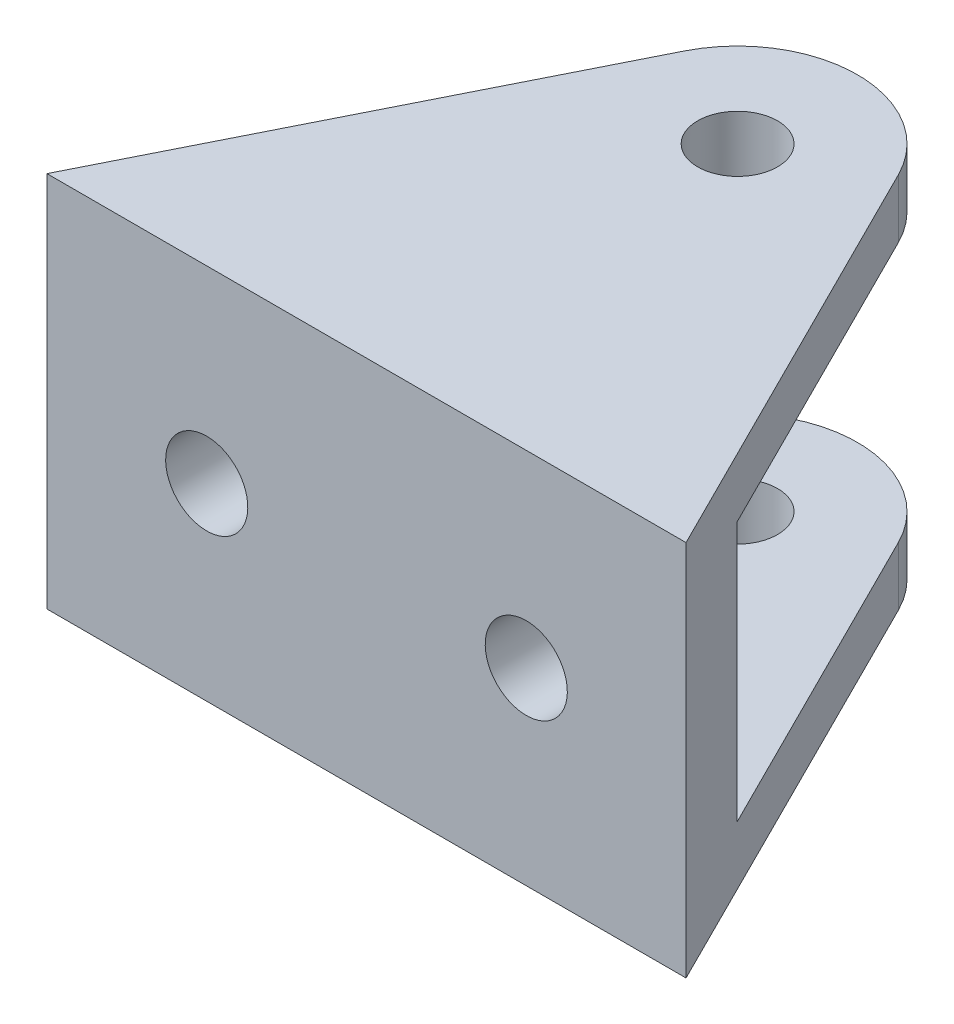
from build123d import *

# Parameters (mm, degrees)
BOSS_EXTRUDE1_DEPTH                                  = 50.8
CBORE_FOR_1_4_BINDING_HEAD_MACHINE_SCREW_D           = 6.5278
CBORE_FOR_1_4_BINDING_HEAD_MACHINE_SCREW_CBORE_D     = 14.2875
CBORE_FOR_1_4_BINDING_HEAD_MACHINE_SCREW_CBORE_DEPTH = 3.302
CUT_EXTRUDE1_REACH                                   = 73.186
SKETCH4_R                                            = 3.175


with BuildPart() as part:
    # Sketch1 → Boss-Extrude1 (new body)
    with BuildSketch(Plane(origin=(0, 0, 0), x_dir=(0, 0, -1), z_dir=(1, 0, 0))):
        Polygon((0, 0), (0, 29.972), (39.856315031, 29.972), (39.856315031, 25.3111), (8.106315031, 25.3111), (8.106315031, 4.6609), (39.856315031, 4.6609), (39.856315031, 0), align=None)
    extrude(amount=BOSS_EXTRUDE1_DEPTH)

    # CBORE for 1/4 Binding Head Machine Screw1 (through all)
    with Locations(Plane(origin=(0, 0, -8.106315031), x_dir=(-1, 0, 0), z_dir=(0, 0, -1))):
        with Locations((-12.7, 14.986), (-38.1, 14.986)):
            CounterBoreHole(CBORE_FOR_1_4_BINDING_HEAD_MACHINE_SCREW_D / 2, CBORE_FOR_1_4_BINDING_HEAD_MACHINE_SCREW_CBORE_D / 2, CBORE_FOR_1_4_BINDING_HEAD_MACHINE_SCREW_CBORE_DEPTH)

    # Cut-Extrude1: up to this face of the body (flat: up to its plane)
    cut_extrude1_end = Plane(part.part.faces().sort_by_distance((25.4, 29.972, -19.928157515))[0])
    # Sketch4 → Cut-Extrude1 (cut, up to the picked face)
    with BuildSketch(Plane.XZ, mode=Mode.PRIVATE) as cut_extrude1_sk1:
        with Locations(Location((25.4, -29.497789369, 0), (0, 0, 270))):
            Circle(SKETCH4_R)
    cut_extrude1_tool1 = split(extrude(cut_extrude1_sk1.sketch, amount=-CUT_EXTRUDE1_REACH, mode=Mode.PRIVATE), bisect_by=cut_extrude1_end, keep=Keep.BOTH, mode=Mode.PRIVATE)
    # Sketch4 → Cut-Extrude1 (cut, up to the picked face)
    with BuildSketch(Plane.XZ, mode=Mode.PRIVATE) as cut_extrude1_sk2:
        with BuildLine():
            Line((0, 0), (16.880765903, -33.757868641))
            ThreePointArc((16.880765903, -33.757868641), (25.4, -39.022789369), (33.919234097, -33.757868641))
            Line((33.919234097, -33.757868641), (50.8, 0))
            Line((50.8, 0), (50.8, -39.856315031))
            Line((50.8, -39.856315031), (0, -39.856315031))
            Line((0, -39.856315031), (0, 0))
        make_face()
    cut_extrude1_tool2 = split(extrude(cut_extrude1_sk2.sketch, amount=-CUT_EXTRUDE1_REACH, mode=Mode.PRIVATE), bisect_by=cut_extrude1_end, keep=Keep.BOTH, mode=Mode.PRIVATE)
    add(cut_extrude1_tool1.solids().sort_by(Axis((25.4, 0, -29.497789), (0, 1, 0)))[0], mode=Mode.SUBTRACT)
    add(cut_extrude1_tool2.solids().sort_by(Axis((7.862872, 0, -17.167721), (0, 1, 0)))[0], mode=Mode.SUBTRACT)


solid = part.part
